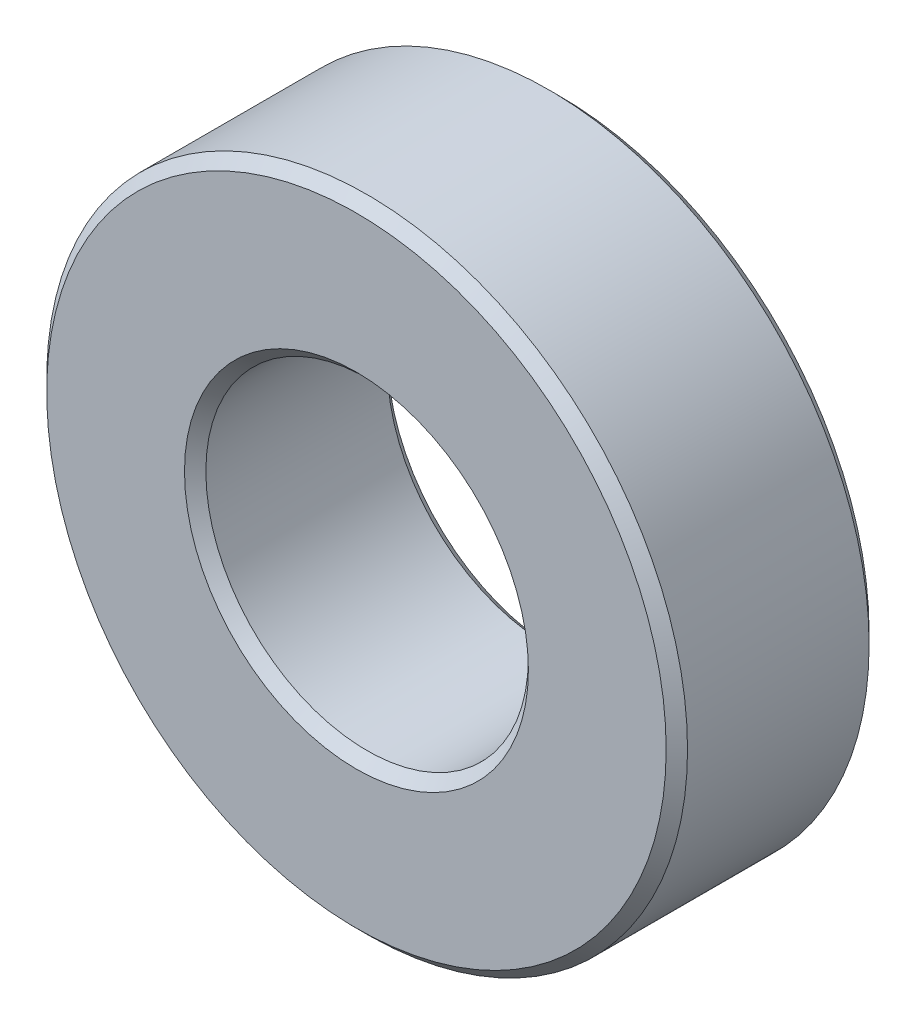
from build123d import *

# Parameters (mm, degrees)
SKETCH_1_R      = 30
SKETCH_1_R_2    = 15.1
EXTRUDE_1_DEPTH = 19
CHAMFER_1_SIZE  = 1


with BuildPart() as part:
    # 草图1 → 凸台-拉伸1 (new body)
    with BuildSketch(Plane.XY):
        Circle(SKETCH_1_R)
        Circle(SKETCH_1_R_2, mode=Mode.SUBTRACT)
    extrude(amount=EXTRUDE_1_DEPTH)

    # 倒角1
    chamfer_1_edges = [part.edges().sort_by_distance(p)[0] for p in [
        (-30, 0, 0),
        (-30, 0, 19),
        (-15.1, 0, 0),
        (-15.1, 0, 19),
    ]]
    chamfer(chamfer_1_edges, length=CHAMFER_1_SIZE)


solid = part.part
